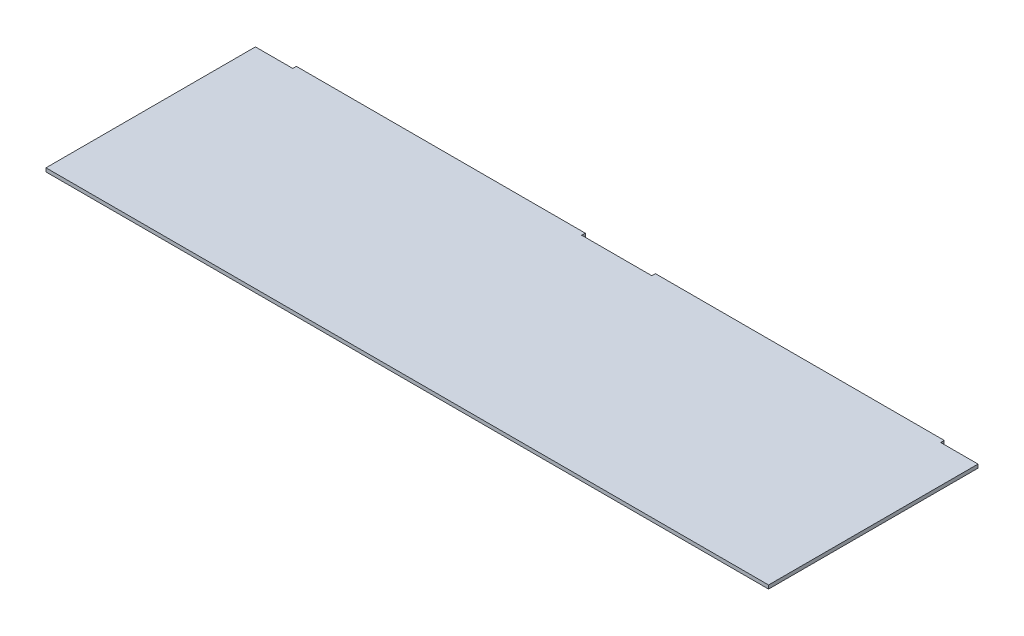
from build123d import *

# Parameters (mm, degrees)
SKETCH1_W           = 635.3556
SKETCH1_H           = 184.15
BOSS_EXTRUDE1_DEPTH = 1.5875
SKETCH2_W           = 254
SKETCH2_H           = 3.175
BOSS_EXTRUDE2_DEPTH = 3.175


with BuildPart() as part:
    # Sketch1 → Boss-Extrude1 (new, symmetric)
    with BuildSketch(Plane(origin=(0, 0, 0), x_dir=(1, 0, 0), z_dir=(0, 1, 0))):
        Rectangle(SKETCH1_W, SKETCH1_H)
    extrude(amount=BOSS_EXTRUDE1_DEPTH, both=True)

    # Sketch2 → Boss-Extrude2 (add)
    with BuildSketch(Plane(origin=(0, 0, -92.075), x_dir=(-1, 0, 0), z_dir=(0, 0, -1))):
        with Locations((-157.8229, 0)):
            Rectangle(SKETCH2_W, SKETCH2_H)
        with Locations((157.8229, 0)):
            Rectangle(SKETCH2_W, SKETCH2_H)
    extrude(amount=BOSS_EXTRUDE2_DEPTH)


solid = part.part
